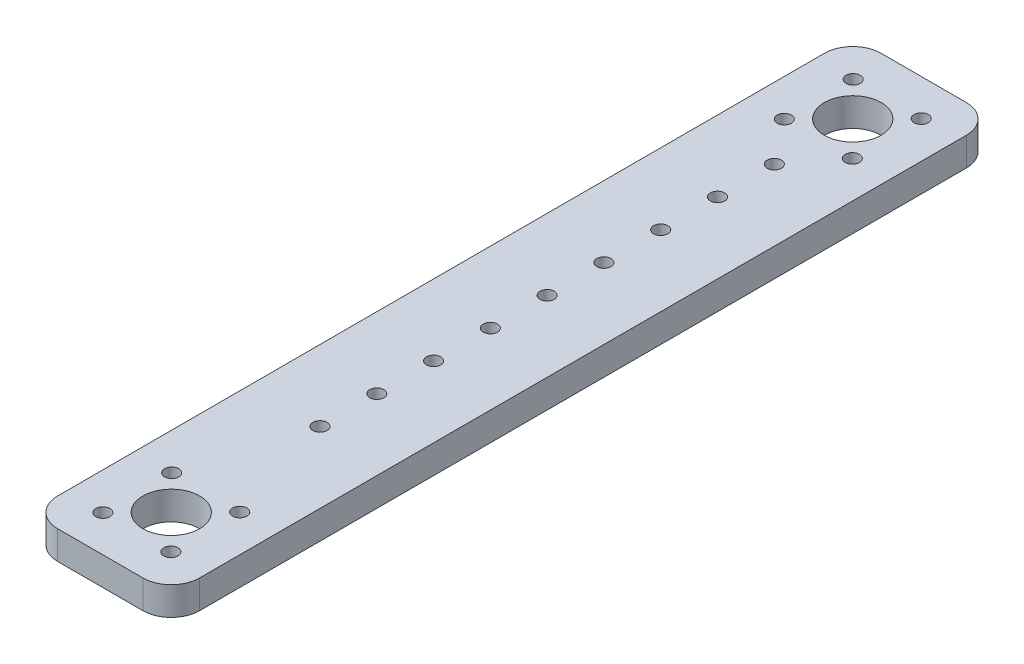
from build123d import *

# Parameters (mm, degrees)
SKETCH2_W                  = 127
SKETCH2_H                  = 736.6
BOSS_EXTRUDE1_DEPTH        = 25.4
F_1_2_0_5_DIAMETER_HOLE1_D = 50.8
F_1_2_0_5_DIAMETER_HOLE2_D = 12.7
FILLET1_R                  = 25.4


with BuildPart() as part:
    # Sketch2 → Boss-Extrude1 (new body)
    with BuildSketch(Plane(origin=(0, 0, 0), x_dir=(1, 0, 0), z_dir=(0, 1, 0))):
        with Locations((-63.5, 368.3)):
            Rectangle(SKETCH2_W, SKETCH2_H)
    extrude(amount=BOSS_EXTRUDE1_DEPTH)

    # 1/2 (0.5) Diameter Hole1 (through all)
    with Locations(Plane(origin=(0, 25.4, 0), x_dir=(1, 0, 0), z_dir=(0, 1, 0))):
        with Locations((-63.5, 673.1), (-63.5, 63.5)):
            Hole(F_1_2_0_5_DIAMETER_HOLE1_D / 2)

    # 1/2 (0.5) Diameter Hole2 (through all)
    with Locations(Plane(origin=(0, 25.4, 0), x_dir=(1, 0, 0), z_dir=(0, 1, 0))):
        with Locations((-93.923508124, 703.915980712), (-33.076491876, 703.915980712), (-33.076491876, 642.284019288), (-93.923508124, 642.284019288), (-63.5, 602.937236364), (-63.5, 552.137236364), (-63.5, 501.337236364), (-63.5, 450.537236364), (-63.5, 399.737236364), (-63.5, 348.937236364), (-63.5, 298.137236364), (-63.5, 247.337236364), (-63.5, 196.537236364), (-93.923508124, 32.684019288), (-93.923508124, 94.315980712), (-33.076491876, 94.315980712), (-33.076491876, 32.684019288)):
            Hole(F_1_2_0_5_DIAMETER_HOLE2_D / 2)

    # Fillet1
    fillet1_edges = [part.edges().sort_by_distance(p)[0] for p in [
        (0, 12.7, 0),
        (-127, 12.7, 0),
        (-127, 12.7, -736.6),
        (0, 12.7, -736.6),
    ]]
    fillet(fillet1_edges, radius=FILLET1_R)


solid = part.part
